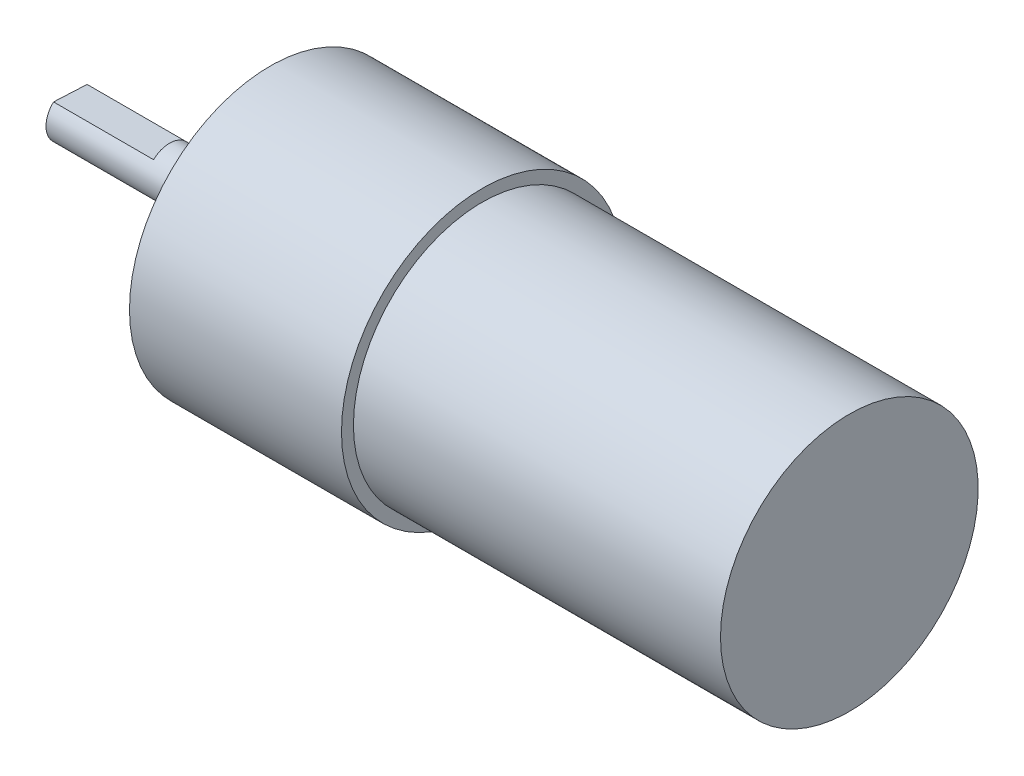
from build123d import *

# Parameters (mm, degrees)
CUT_EXTRUDE1_DEPTH = 8.5
SKETCH4_R          = 1
CUT_EXTRUDE2_DEPTH = 10


with BuildPart() as part:
    # Sketch2 → Revolve1 (revolve)
    with BuildSketch(Plane(origin=(0, 0, 0), x_dir=(1, 0, 0), z_dir=(0, 1, 0)), mode=Mode.PRIVATE) as revolve1_sk:
        Polygon((-41.724352159, 0), (24.555647841, 0), (24.555647841, 10.95), (-6.644352159, 10.95), (-6.644352159, 11.965), (-24.664352159, 11.965), (-24.664352159, 4.97), (-27.494352159, 4.97), (-27.494352159, 3.965), (-28.224352159, 3.965), (-28.224352159, 3.2), (-28.824352159, 3.2), (-28.824352159, 2), (-41.724352159, 2), align=None)
    revolve(revolve1_sk.sketch.rotate(Axis((-41.724352159, 0, 0), (1, 0, 0)), 180), axis=Axis((-41.724352159, 0, 0), (1, 0, 0)))

    # Sketch3 → Cut-Extrude1 (cut)
    with BuildSketch(Plane.ZY.offset(41.724352159)):
        with BuildLine():
            Line((-1.493929209, 1.329727611), (1.359340223, 1.467035841))
            ThreePointArc((1.359340223, 1.467035841), (-0.096134989, 1.99768818), (-1.493929209, 1.329727611))
        make_face()
    extrude(amount=-CUT_EXTRUDE1_DEPTH, mode=Mode.SUBTRACT)

    # Sketch4 → Cut-Extrude2 (cut)
    with BuildSketch(Plane.ZY.offset(24.664352159)):
        with Locations((-2.529015446, 8.04098341)):
            Circle(SKETCH4_R)
        with Locations((-5.699188182, -6.210683328)):
            Circle(SKETCH4_R)
        with Locations((8.228203628, -1.830300082)):
            Circle(SKETCH4_R)
    extrude(amount=-CUT_EXTRUDE2_DEPTH, mode=Mode.SUBTRACT)


solid = part.part
